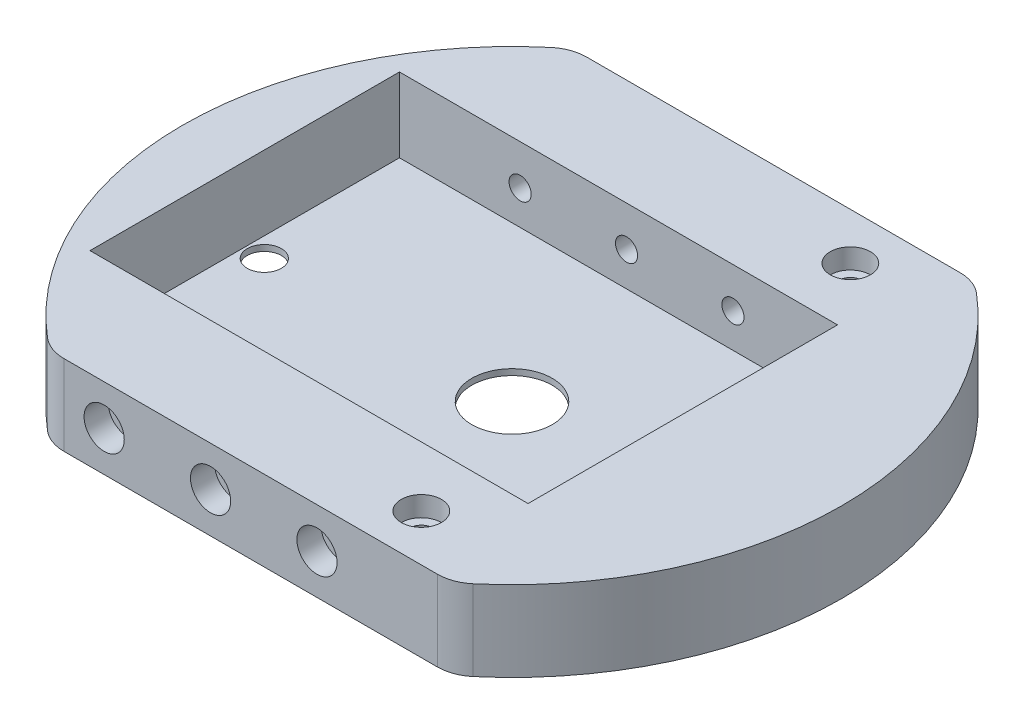
from build123d import *

# Parameters (mm, degrees)
BOSS_EXTRUDE1_DEPTH = 20
FILLET1_R           = 10
SKETCH2_W           = 109
SKETCH2_H           = 77
CUT_EXTRUDE1_DEPTH  = 18.5
SKETCH4_R           = 8.25
SKETCH4_R_2         = 4.25
CUT_EXTRUDE2_DEPTH  = 10
SKETCH5_R           = 10
CUT_EXTRUDE3_DEPTH  = 10
SKETCH6_R           = 2.75
CUT_EXTRUDE4_DEPTH  = 30
CUT_EXTRUDE5_START  = -30
SKETCH7_R           = 2.75
CUT_EXTRUDE5_DEPTH  = 30
SKETCH8_R           = 5
CUT_EXTRUDE6_DEPTH  = 6
CUT_EXTRUDE7_START  = -6
SKETCH9_R           = 5
CUT_EXTRUDE7_DEPTH  = 6
SKETCH10_R          = 2.75
CUT_EXTRUDE8_DEPTH  = 20
SKETCH11_R          = 5
CUT_EXTRUDE9_DEPTH  = 5


with BuildPart() as part:
    # Sketch1 → Boss-Extrude1 (new body)
    with BuildSketch(Plane(origin=(0, 0, 0), x_dir=(1, 0, 0), z_dir=(0, 1, 0))):
        with BuildLine():
            Line((-50, -65), (50, -65))
            ThreePointArc((50, -65), (82.006097334, 0), (50, 65))
            Line((50, 65), (-50, 65))
            ThreePointArc((-50, 65), (-82.006097334, 0), (-50, -65))
        make_face()
    extrude(amount=BOSS_EXTRUDE1_DEPTH)

    # Fillet1
    fillet1_edges = [part.edges().sort_by_distance(p)[0] for p in [
        (-50, 10, -65),
        (50, 10, -65),
        (50, 10, 65),
        (-50, 10, 65),
    ]]
    fillet(fillet1_edges, radius=FILLET1_R)

    # Sketch2 → Cut-Extrude1 (cut)
    with BuildSketch(Plane(origin=(0, 20, 0), x_dir=(1, 0, 0), z_dir=(0, 1, 0))):
        with Locations((-12, 0)):
            Rectangle(SKETCH2_W, SKETCH2_H)
    extrude(amount=-CUT_EXTRUDE1_DEPTH, mode=Mode.SUBTRACT)

    # Sketch4 → Cut-Extrude2 (cut)
    with BuildSketch(Plane.XZ):
        with Locations((30.815, 53.373145635)):
            Circle(SKETCH4_R)
        with Locations((30.815, -53.373145635)):
            Circle(SKETCH4_R)
        with Locations((-61.63, 0)):
            Circle(SKETCH4_R_2)
    extrude(amount=-CUT_EXTRUDE2_DEPTH, mode=Mode.SUBTRACT)

    # Sketch5 → Cut-Extrude3 (cut)
    with BuildSketch(Plane(origin=(0, 1.5, 0), x_dir=(1, 0, 0), z_dir=(0, 1, 0))):
        Circle(SKETCH5_R)
    extrude(amount=-CUT_EXTRUDE3_DEPTH, mode=Mode.SUBTRACT)

    # Sketch6 → Cut-Extrude4 (cut)
    with BuildSketch(Plane.XY.offset(65)):
        with Locations((-36.474488199, 10)):
            Circle(SKETCH6_R)
        with Locations((-10.000511801, 10)):
            Circle(SKETCH6_R)
        with Locations((16.474488199, 10)):
            Circle(SKETCH6_R)
    extrude(amount=-CUT_EXTRUDE4_DEPTH, mode=Mode.SUBTRACT)

    # Sketch7 → Cut-Extrude5 (cut)
    with BuildSketch(Plane(origin=(0, 0, -65), x_dir=(-1, 0, 0), z_dir=(0, 0, -1)).offset(CUT_EXTRUDE5_START)):
        with Locations((-16.474488199, 10)):
            Circle(SKETCH7_R)
        with Locations((10.000511801, 10)):
            Circle(SKETCH7_R)
        with Locations((36.474488199, 10)):
            Circle(SKETCH7_R)
    extrude(amount=CUT_EXTRUDE5_DEPTH, mode=Mode.SUBTRACT)

    # Sketch8 → Cut-Extrude6 (cut)
    with BuildSketch(Plane.XY.offset(65)):
        with Locations((-36.474488199, 10)):
            Circle(SKETCH8_R)
        with Locations((-10.000511801, 10)):
            Circle(SKETCH8_R)
        with Locations((16.474488199, 10)):
            Circle(SKETCH8_R)
    extrude(amount=-CUT_EXTRUDE6_DEPTH, mode=Mode.SUBTRACT)

    # Sketch9 → Cut-Extrude7 (cut)
    with BuildSketch(Plane(origin=(0, 0, -65), x_dir=(-1, 0, 0), z_dir=(0, 0, -1)).offset(CUT_EXTRUDE7_START)):
        with Locations((-16.474488199, 10)):
            Circle(SKETCH9_R)
        with Locations((10.000511801, 10)):
            Circle(SKETCH9_R)
        with Locations((36.474488199, 10)):
            Circle(SKETCH9_R)
    extrude(amount=CUT_EXTRUDE7_DEPTH, mode=Mode.SUBTRACT)

    # Sketch10 → Cut-Extrude8 (cut)
    with BuildSketch(Plane.XZ.offset(-10)):
        with Locations((30.815, 53.373145635)):
            Circle(SKETCH10_R)
        with Locations((30.815, -53.373145635)):
            Circle(SKETCH10_R)
    extrude(amount=-CUT_EXTRUDE8_DEPTH, mode=Mode.SUBTRACT)

    # Sketch11 → Cut-Extrude9 (cut)
    with BuildSketch(Plane(origin=(0, 20, 0), x_dir=(1, 0, 0), z_dir=(0, 1, 0))):
        with Locations((30.815, 53.373145635)):
            Circle(SKETCH11_R)
        with Locations((30.815, -53.373145635)):
            Circle(SKETCH11_R)
    extrude(amount=-CUT_EXTRUDE9_DEPTH, mode=Mode.SUBTRACT)


solid = part.part
